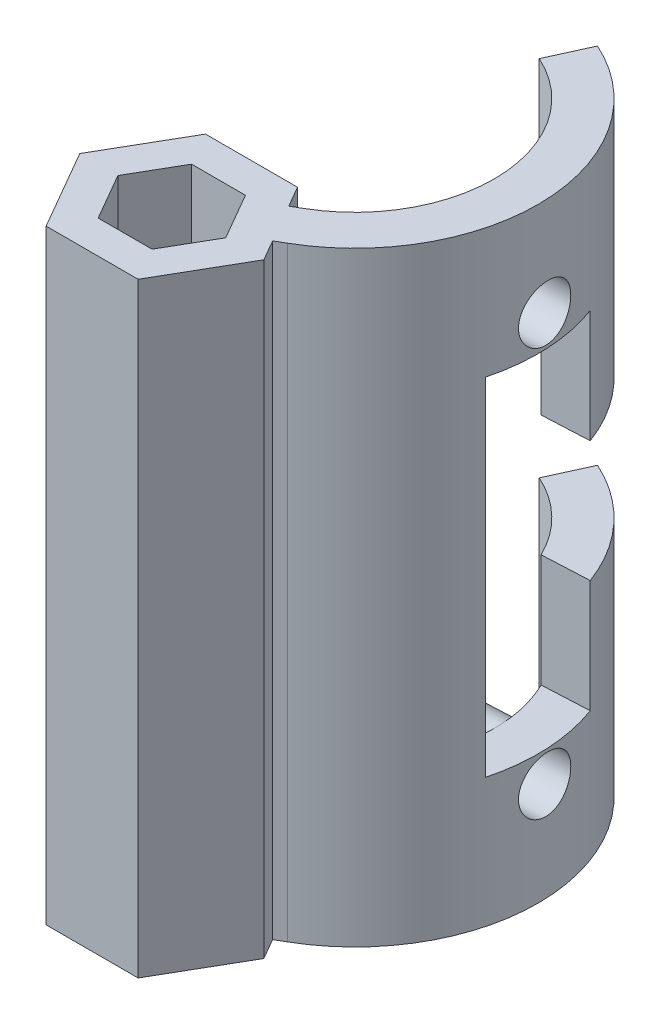
from build123d import *

# Parameters (mm, degrees)
BOSS_EXTRUDE1_DEPTH = 55
SKETCH2_W           = 4
SKETCH2_H           = 55
SKETCH6_R           = 2.5
CUT_EXTRUDE1_DEPTH  = 10
SKETCH7_W           = 10
SKETCH7_H           = 31.5
CUT_EXTRUDE2_DEPTH  = 10
SKETCH8_W           = 9.818662261
SKETCH8_H           = 11
CUT_EXTRUDE3_DEPTH  = 69.208914829
BOSS_EXTRUDE2_START = -3.6
SKETCH9_R           = 2.8
SKETCH9_R_2         = 1.7
BOSS_EXTRUDE2_DEPTH = 7


with BuildPart() as part:
    # Sketch1 → Boss-Extrude1 (new body)
    with BuildSketch(Plane(origin=(0, 0, 0), x_dir=(1, 0, 0), z_dir=(0, 1, 0))):
        Polygon((-4.182050808, 7.243524479), (-8.364101615, 0), (-4.182050808, -7.243524479), (4.182050808, -7.243524479), (8.364101615, 0), (4.182050808, 7.243524479), align=None)
        Polygon((-4.9, 0), (-2.45, -4.243524479), (2.45, -4.243524479), (4.9, 0), (2.45, 4.243524479), (-2.45, 4.243524479), align=None, mode=Mode.SUBTRACT)
    extrude(amount=BOSS_EXTRUDE1_DEPTH)

    # Sweep1: sweep along a path in Sketch3
    with BuildLine(Plane(origin=(0, 55, 0), x_dir=(1, 0, 0), z_dir=(0, 1, 0))) as sweep1_path:
        Line((6.273076211, 3.621762239), (7.139101615, 4.121762239))
        ThreePointArc((7.139101615, 4.121762239), (13.761110972, 12.313986191), (13.182050808, 22.831981747))
        ThreePointArc((13.182050808, 22.831981747), (10.196814467, 27.168510904), (5.872312911, 30.17114432))
    # Sketch2 → Sweep1 (sweep)
    with BuildSketch(Plane(origin=(6.273076211, 0, -3.621762239), x_dir=(-0.5000000000000001, 0, -0.8660254037844386), z_dir=(0.8660254037844386, 0, -0.5000000000000001))):
        with Locations((0, 27.5)):
            Rectangle(SKETCH2_W, SKETCH2_H)
    sweep(path=sweep1_path.line)

    # Sketch6 → Cut-Extrude1 (cut)
    with BuildSketch(Plane(origin=(17.267694528, 0, -0.839732793), x_dir=(-0.0485728772715999, 0, -0.9988196411732992), z_dir=(0.9988196411732992, 0, -0.0485728772715999))):
        with Locations((16.810213392, 46.05)):
            Circle(SKETCH6_R)
        with Locations((16.810213392, 8.95)):
            Circle(SKETCH6_R)
    extrude(amount=-CUT_EXTRUDE1_DEPTH, mode=Mode.SUBTRACT)

    # Sketch7 → Cut-Extrude2 (cut)
    with BuildSketch(Plane(origin=(17.267694528, 0, -0.839732793), x_dir=(-0.0485728772715999, 0, -0.9988196411732992), z_dir=(0.9988196411732992, 0, -0.0485728772715999))):
        with Locations((16.810213392, 27.5)):
            Rectangle(SKETCH7_W, SKETCH7_H)
    extrude(amount=-CUT_EXTRUDE2_DEPTH, mode=Mode.SUBTRACT)

    # Sketch8 → Cut-Extrude3 (cut, through all)
    with BuildSketch(Plane(origin=(17.267694528, 0, -0.839732793), x_dir=(-0.0485728772715999, 0, -0.9988196411732992), z_dir=(0.9988196411732992, 0, -0.0485728772715999))):
        with Locations((26.719544523, 27.5)):
            Rectangle(SKETCH8_W, SKETCH8_H)
    extrude(amount=-CUT_EXTRUDE3_DEPTH, mode=Mode.SUBTRACT)

    # Sketch9 → Boss-Extrude2 (add)
    # profile 1 of 2: a face of its own
    with BuildSketch(Plane(origin=(17.267694528, 0, -0.839732793), x_dir=(-0.0485728772715999, 0, -0.9988196411732992), z_dir=(0.9988196411732992, 0, -0.0485728772715999)).offset(BOSS_EXTRUDE2_START)):
        with Locations((16.810213392, 46.05)):
            Circle(SKETCH9_R)
        with Locations(Location((16.810213392, 46.05, 0), (0, 0, 180))):
            Circle(SKETCH9_R_2, mode=Mode.SUBTRACT)
    # profile 2 of 2: a face of its own
    with BuildSketch(Plane(origin=(17.267694528, 0, -0.839732793), x_dir=(-0.0485728772715999, 0, -0.9988196411732992), z_dir=(0.9988196411732992, 0, -0.0485728772715999)).offset(BOSS_EXTRUDE2_START)):
        with Locations(Location((16.810213392, 8.95, 0), (0, 0, 90.000000002))):
            Circle(SKETCH9_R)
        with Locations((16.810213392, 8.95)):
            Circle(SKETCH9_R_2, mode=Mode.SUBTRACT)
    extrude(amount=-BOSS_EXTRUDE2_DEPTH)


solid = part.part
